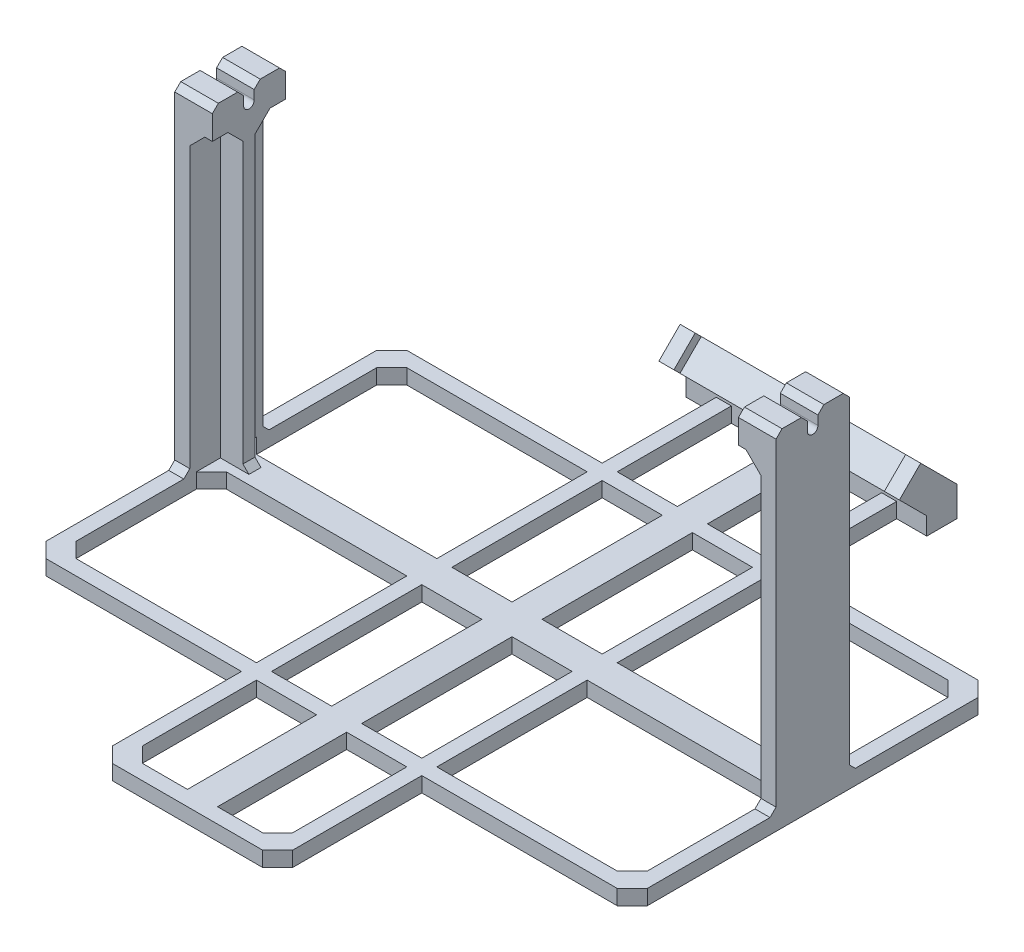
from build123d import *

# Parameters (mm, degrees)
SKETCH1_W                = 200
SKETCH1_H                = 120
SKETCH1_W_2              = 190
SKETCH1_H_2              = 110
BOSS_EXTRUDE1_DEPTH      = 5
SKETCH2_W                = 5
SKETCH2_H                = 24.351612872
BOSS_EXTRUDE2_DEPTH      = 100
SKETCH3_W                = 190
SKETCH3_H                = 10
BOSS_EXTRUDE3_DEPTH      = 5
SKETCH4_W                = 12.5
SKETCH4_H                = 24.351612872
BOSS_EXTRUDE4_DEPTH      = 10
BOSS_EXTRUDE5_DEPTH      = 2
BOSS_EXTRUDE5_DEPTH_BACK = 2
SKETCH5_W                = 7.5
SKETCH5_H                = 100
CUT_EXTRUDE1_DEPTH       = 239.379948821
SKETCH7_W                = 60
SKETCH7_H                = 215.9
SKETCH7_W_2              = 50
SKETCH7_H_2              = 205.9
BOSS_EXTRUDE6_DEPTH      = 5
CHAMFER1_SIZE            = 2
SKETCH8_W                = 10
SKETCH8_H                = 205.9
BOSS_EXTRUDE7_DEPTH      = 5
CHAMFER2_SIZE            = 5
BOSS_EXTRUDE8_DEPTH      = 40
BOSS_EXTRUDE8_DEPTH_BACK = 40
SKETCH9_W                = 10
SKETCH9_H                = 5
SKETCH10_W               = 35
SKETCH10_H               = 14.142135624
SKETCH10_R               = 1.27
BOSS_EXTRUDE9_DEPTH      = 10
SKETCH12_R               = 1.27
CUT_EXTRUDE2_DEPTH       = 199.832576328


with BuildPart() as part:
    # Sketch1 → Boss-Extrude1 (new body)
    with BuildSketch(Plane(origin=(0, 0, 0), x_dir=(1, 0, 0), z_dir=(0, 1, 0))):
        Rectangle(SKETCH1_W, SKETCH1_H)
        Rectangle(SKETCH1_W_2, SKETCH1_H_2, mode=Mode.SUBTRACT)
    extrude(amount=BOSS_EXTRUDE1_DEPTH)

    # Sketch2 → Boss-Extrude2 (add)
    with BuildSketch(Plane(origin=(0, 5, 0), x_dir=(1, 0, 0), z_dir=(0, 1, 0))):
        with Locations((-97.5, 0)):
            Rectangle(SKETCH2_W, SKETCH2_H)
        with Locations((97.5, 0)):
            Rectangle(SKETCH2_W, SKETCH2_H)
    extrude(amount=BOSS_EXTRUDE2_DEPTH)

    # Sketch3 → Boss-Extrude3 (add)
    with BuildSketch(Plane.XZ):
        Rectangle(SKETCH3_W, SKETCH3_H)
    extrude(amount=-BOSS_EXTRUDE3_DEPTH)

    # Sketch4 → Boss-Extrude4 (add)
    with BuildSketch(Plane(origin=(0, 105, 0), x_dir=(1, 0, 0), z_dir=(0, 1, 0))):
        with Locations((93.75, 0)):
            Rectangle(SKETCH4_W, SKETCH4_H)
        with Locations((-93.75, 0)):
            Rectangle(SKETCH4_W, SKETCH4_H)
    extrude(amount=BOSS_EXTRUDE4_DEPTH)

    # Sketch5 → Boss-Extrude5 (add, two sides: drawn at the far end of the back side and taken through both)
    with BuildSketch(Plane.XY.offset(-BOSS_EXTRUDE5_DEPTH_BACK)):
        with Locations((-91.25, 55)):
            Rectangle(SKETCH5_W, SKETCH5_H)
        with Locations((91.25, 55)):
            Rectangle(SKETCH5_W, SKETCH5_H)
    extrude(amount=BOSS_EXTRUDE5_DEPTH + BOSS_EXTRUDE5_DEPTH_BACK)

    # Sketch6 → Cut-Extrude1 (cut, through all)
    with BuildSketch(Plane(origin=(100, 0, 0), x_dir=(0, 0, -1), z_dir=(1, 0, 0))):
        with BuildLine():
            Line((1.75, 120), (1.75, 110))
            ThreePointArc((1.75, 110), (0, 108.25), (-1.75, 110))
            Line((-1.75, 110), (-1.75, 120))
            ThreePointArc((-1.75, 120), (0, 121.75), (1.75, 120))
        make_face()
    extrude(amount=-CUT_EXTRUDE1_DEPTH, mode=Mode.SUBTRACT)

    # Sketch7 → Boss-Extrude6 (add)
    with BuildSketch(Plane(origin=(0, 5, 0), x_dir=(1, 0, 0), z_dir=(0, 1, 0))):
        Rectangle(SKETCH7_W, SKETCH7_H)
        Rectangle(SKETCH7_W_2, SKETCH7_H_2, mode=Mode.SUBTRACT)
    extrude(amount=-BOSS_EXTRUDE6_DEPTH)

    # Chamfer1
    chamfer1_edges = [part.edges().sort_by_distance(p)[0] for p in [
        (-93.75, 115, -1.75),
        (-93.75, 115, 1.75),
        (93.75, 115, 1.75),
        (93.75, 115, -1.75),
        (97.5, 5, 12.175806436),
        (87.5, 5, 0),
        (97.5, 5, -12.175806436),
        (-97.5, 5, -12.175806436),
        (-87.5, 5, 0),
        (-97.5, 5, 12.175806436),
        (-93.75, 115, 12.175806436),
        (-93.75, 115, -12.175806436),
        (93.75, 115, -12.175806436),
        (93.75, 115, 12.175806436),
    ]]
    chamfer(chamfer1_edges, length=CHAMFER1_SIZE)

    # Sketch8 → Boss-Extrude7 (add)
    with BuildSketch(Plane(origin=(0, 5, 0), x_dir=(1, 0, 0), z_dir=(0, 1, 0))):
        Rectangle(SKETCH8_W, SKETCH8_H)
    extrude(amount=-BOSS_EXTRUDE7_DEPTH)

    # Chamfer2
    chamfer2_edges = [part.edges().sort_by_distance(p)[0] for p in [
        (-95, 105, -7.087903218),
        (-91.25, 105, -2),
        (-91.25, 105, 2),
        (95, 105, 7.087903218),
        (91.25, 105, -2),
        (91.25, 105, 2),
        (-95, 2.5, 55),
        (95, 2.5, 55),
        (95, 2.5, -55),
        (-95, 2.5, -55),
        (-30, 2.5, 107.95),
        (30, 2.5, -107.95),
        (-25, 2.5, -102.95),
        (25, 2.5, 102.95),
        (-30, 2.5, -107.95),
        (30, 2.5, 107.95),
        (-25, 2.5, 102.95),
        (25, 2.5, -102.95),
        (-95, 105, 7.087903218),
        (95, 105, -7.087903218),
        (95, 2.5, 5),
        (95, 2.5, -5),
        (-95, 2.5, -5),
        (-95, 2.5, 5),
        (100, 2.5, 60),
        (-100, 2.5, 60),
        (-100, 2.5, -60),
        (100, 2.5, -60),
    ]]
    chamfer(chamfer2_edges, length=CHAMFER2_SIZE)

    # Sketch9 → Boss-Extrude8 (add, two sides: drawn at the far end of the back side and taken through both)
    with BuildSketch(Plane(origin=(0, 0, 0), x_dir=(0, 0, -1), z_dir=(1, 0, 0)).offset(-BOSS_EXTRUDE8_DEPTH_BACK)):
        Polygon((97.95, 5), (107.95, 5), (107.95, 10), (97.95, 20), align=None)
        with Locations((102.95, 2.5)):
            Rectangle(SKETCH9_W, SKETCH9_H)
    extrude(amount=BOSS_EXTRUDE8_DEPTH + BOSS_EXTRUDE8_DEPTH_BACK)

    # Sketch10 → Boss-Extrude9 (add)
    # profile 1 of 4: a face of its own
    with BuildSketch(Plane(origin=(0, 58.975, -58.975), x_dir=(1, 0, 0), z_dir=(0, 0.7071067811865489, -0.7071067811865461))):
        with Locations((-17.5, 62.190041405)):
            Rectangle(SKETCH10_W, SKETCH10_H)
    # profile 2 of 4: a face of its own
    with BuildSketch(Plane(origin=(0, 58.975, -58.975), x_dir=(1, 0, 0), z_dir=(0, 0.7071067811865489, -0.7071067811865461))):
        with Locations((17.5, 62.190041405)):
            Rectangle(SKETCH10_W, SKETCH10_H)
    # profile 3 of 4: a face of its own
    with BuildSketch(Plane(origin=(0, 58.975, -58.975), x_dir=(1, 0, 0), z_dir=(0, 0.7071067811865489, -0.7071067811865461))):
        Polygon((35, 69.261109217), (35, 55.118973593), (35, 52.261109217), (40, 52.261109217), (40, 69.261109217), align=None)
        with Locations(Location((37.425, 56.310241705, 0), (0, 0, 270))):
            Circle(SKETCH10_R, mode=Mode.SUBTRACT)
    # profile 4 of 4: a face of its own
    with BuildSketch(Plane(origin=(0, 58.975, -58.975), x_dir=(1, 0, 0), z_dir=(0, 0.7071067811865489, -0.7071067811865461))):
        Polygon((-35, 52.261109217), (-35, 55.118973593), (-35, 69.261109217), (-40, 69.261109217), (-40, 52.261109217), align=None)
        with Locations(Location((-37.425, 56.310241705, 0), (0, 0, 270))):
            Circle(SKETCH10_R, mode=Mode.SUBTRACT)
    extrude(amount=-BOSS_EXTRUDE9_DEPTH)

    # Sketch12 → Cut-Extrude2 (cut, through all)
    with BuildSketch(Plane(origin=(0, 51.903932188, -51.903932188), x_dir=(1, 0, 0), z_dir=(0, -0.7071067811865488, 0.7071067811865464))):
        with Locations(Location((37.425, -56.310241705, 0), (0, 0, 90.000000005))):
            Circle(SKETCH12_R)
        with Locations(Location((-37.425, -56.310241705, 0), (0, 0, 89.999999995))):
            Circle(SKETCH12_R)
    extrude(amount=-CUT_EXTRUDE2_DEPTH, mode=Mode.SUBTRACT)


solid = part.part
